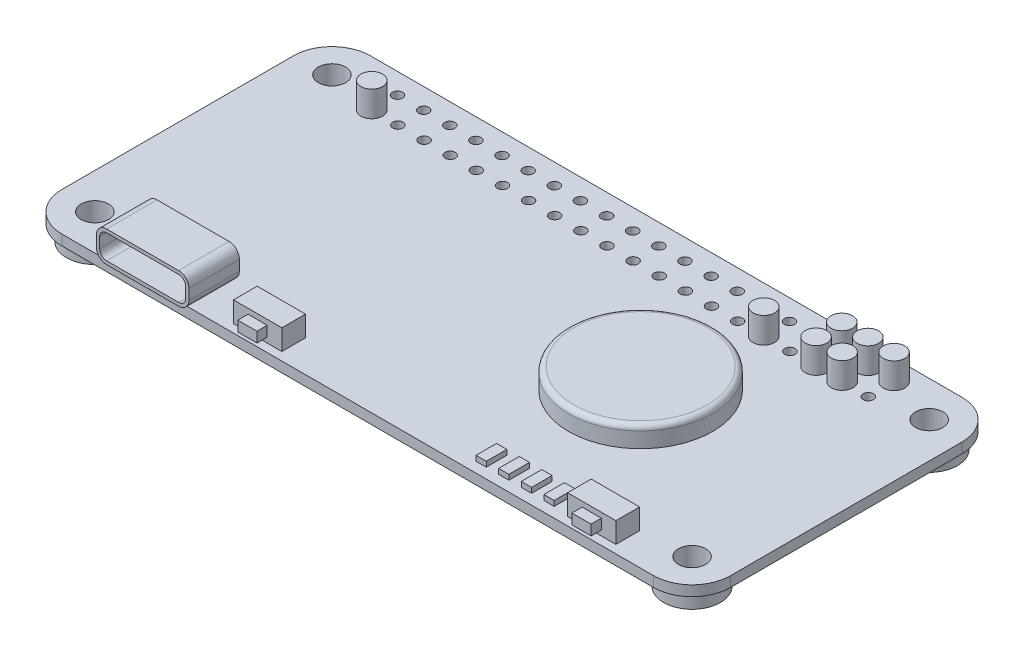
from build123d import *

# Parameters (mm, degrees)
BOSS_EXTRUDE1_DEPTH      = 1
SKETCH2_R                = 1.325
CUT_EXTRUDE1_DEPTH       = 36.80851854
SKETCH3_R                = 0.5
CUT_EXTRUDE2_DEPTH       = 36.80851854
LPATTERN1_COUNT          = 20
LPATTERN1_PITCH          = 2.54
BOSS_EXTRUDE6_DEPTH      = 0.4
BOSS_EXTRUDE6_DEPTH_BACK = 4.5
CUT_EXTRUDE9_DEPTH       = 5.25
SKETCH_1_W               = 4.7
SKETCH_1_H               = 2.3
EXTRUDE_1_DEPTH          = 2
SKETCH_2_W               = 1.86
SKETCH_2_H               = 1
EXTRUDE_2_DEPTH          = 1
SKETCH_9_R               = 2.75
SKETCH_9_R_2             = 1.325
EXTRUDE_8_DEPTH          = 1.5
SKETCH_10_R              = 1.05
EXTRUDE_9_DEPTH          = 2.5
SKETCH_11_R              = 0.5
EXTRUDE_10_DEPTH         = 3
SKETCH_12_R              = 7
EXTRUDE_11_DEPTH         = 2
SKETCH_13_W              = 1
SKETCH_13_H              = 2
EXTRUDE_12_DEPTH         = 0.5
FILLET_1_R               = 0.5
EXTRUDE_13_DEPTH         = 1


with BuildPart() as part:
    # Sketch1 → Boss-Extrude1 (new body)
    with BuildSketch(Plane(origin=(0, 0, 0), x_dir=(1, 0, 0), z_dir=(0, 1, 0))):
        with BuildLine():
            Line((-28.75, 15), (28.75, 15))
            ThreePointArc((28.75, 15), (31.401650429, 13.901650429), (32.5, 11.25))
            Line((32.5, 11.25), (32.5, -11.25))
            ThreePointArc((32.5, -11.25), (31.401650429, -13.901650429), (28.75, -15))
            Line((28.75, -15), (-28.75, -15))
            ThreePointArc((-28.75, -15), (-31.401650429, -13.901650429), (-32.5, -11.25))
            Line((-32.5, -11.25), (-32.5, 11.25))
            ThreePointArc((-32.5, 11.25), (-31.401650429, 13.901650429), (-28.75, 15))
        make_face()
    extrude(amount=BOSS_EXTRUDE1_DEPTH)

    # Sketch2 → Cut-Extrude1 (cut, through all)
    with BuildSketch(Plane(origin=(0, 1, 0), x_dir=(1, 0, 0), z_dir=(0, 1, 0))):
        with Locations(Location((-29.025, 11.525, 0), (0, 0, 270))):
            Circle(SKETCH2_R)
        with Locations(Location((29.025, 11.525, 0), (0, 0, 90))):
            Circle(SKETCH2_R)
        with Locations(Location((29.025, -11.525, 0), (0, 0, 270))):
            Circle(SKETCH2_R)
        with Locations(Location((-29.025, -11.525, 0), (0, 0, 90))):
            Circle(SKETCH2_R)
    extrude(amount=-CUT_EXTRUDE1_DEPTH, mode=Mode.SUBTRACT)

    # Sketch3 → Cut-Extrude2 (cut, through all)
    with BuildSketch(Plane(origin=(0, 1, 0), x_dir=(1, 0, 0), z_dir=(0, 1, 0))):
        with Locations(Location((-24.128, 13, 0), (0, 0, 270))):
            Circle(SKETCH3_R)
        with Locations(Location((-24.128, 10.5, 0), (0, 0, 270))):
            Circle(SKETCH3_R)
    cut_extrude2 = extrude(amount=-CUT_EXTRUDE2_DEPTH, mode=Mode.SUBTRACT)

    # LPattern1: Cut-Extrude2 ×20
    with Locations(*[(i * LPATTERN1_PITCH, 0, 0) for i in range(1, LPATTERN1_COUNT)]):
        add(cut_extrude2, mode=Mode.SUBTRACT)

    # Sketch15 → Boss-Extrude6 (add, two sides: drawn at the far end of the back side and taken through both)
    with BuildSketch(Plane.XY.offset(15).offset(-BOSS_EXTRUDE6_DEPTH_BACK)):
        with BuildLine():
            Line((-24, 4), (-17, 4))
            ThreePointArc((-17, 4), (-16.292893219, 3.707106781), (-16, 3))
            Line((-16, 3), (-16, 2))
            ThreePointArc((-16, 2), (-16.292893219, 1.292893219), (-17, 1))
            Line((-17, 1), (-24, 1))
            ThreePointArc((-24, 1), (-24.707106781, 1.292893219), (-25, 2))
            Line((-25, 2), (-25, 3))
            ThreePointArc((-25, 3), (-24.707106781, 3.707106781), (-24, 4))
        make_face()
    extrude(amount=BOSS_EXTRUDE6_DEPTH + BOSS_EXTRUDE6_DEPTH_BACK)

    # Sketch16 → Cut-Extrude9 (cut)
    with BuildSketch(Plane.XY.offset(15.4)):
        with BuildLine():
            Line((-17, 3.68), (-24, 3.68))
            ThreePointArc((-24, 3.68), (-24.480832611, 3.480832611), (-24.68, 3))
            Line((-24.68, 3), (-24.68, 2))
            ThreePointArc((-24.68, 2), (-24.480832611, 1.519167389), (-24, 1.32))
            Line((-24, 1.32), (-17, 1.32))
            ThreePointArc((-17, 1.32), (-16.519167389, 1.519167389), (-16.32, 2))
            Line((-16.32, 2), (-16.32, 3))
            ThreePointArc((-16.32, 3), (-16.519167389, 3.480832611), (-17, 3.68))
        make_face()
    extrude(amount=-CUT_EXTRUDE9_DEPTH, mode=Mode.SUBTRACT)

    # 草图1 → 凸台-拉伸1 (add)
    with BuildSketch(Plane(origin=(0, 1, 0), x_dir=(1, 0, 0), z_dir=(0, 1, 0))):
        with Locations((-10.52, -13.05)):
            Rectangle(SKETCH_1_W, SKETCH_1_H)
        with Locations((21.95, -13.05)):
            Rectangle(SKETCH_1_W, SKETCH_1_H)
    extrude(amount=EXTRUDE_1_DEPTH)

    # 草图2 → 凸台-拉伸2 (add)
    with BuildSketch(Plane.XY.offset(14.2)):
        with Locations((-10.52, 2)):
            Rectangle(SKETCH_2_W, SKETCH_2_H)
        with Locations((21.95, 2)):
            Rectangle(SKETCH_2_W, SKETCH_2_H)
    extrude(amount=EXTRUDE_2_DEPTH)

    # 草图9 → 凸台-拉伸8 (add)
    # profile 1 of 4: a face of its own
    with BuildSketch(Plane.XZ):
        with Locations(Location((29.025, 11.525, 0), (0, 0, 90))):
            Circle(SKETCH_9_R)
        with Locations(Location((29.025, 11.525, 0), (0, 0, 90))):
            Circle(SKETCH_9_R_2, mode=Mode.SUBTRACT)
    # profile 2 of 4: a face of its own
    with BuildSketch(Plane.XZ):
        with Locations(Location((29.025, -11.525, 0), (0, 0, 90))):
            Circle(SKETCH_9_R)
        with Locations(Location((29.025, -11.525, 0), (0, 0, 270))):
            Circle(SKETCH_9_R_2, mode=Mode.SUBTRACT)
    # profile 3 of 4: a face of its own
    with BuildSketch(Plane.XZ):
        with Locations(Location((-29.025, 11.525, 0), (0, 0, 90))):
            Circle(SKETCH_9_R)
        with Locations(Location((-29.025, 11.525, 0), (0, 0, 270))):
            Circle(SKETCH_9_R_2, mode=Mode.SUBTRACT)
    # profile 4 of 4: a face of its own
    with BuildSketch(Plane.XZ):
        with Locations(Location((-29.025, -11.525, 0), (0, 0, 90))):
            Circle(SKETCH_9_R)
        with Locations(Location((-29.025, -11.525, 0), (0, 0, 90))):
            Circle(SKETCH_9_R_2, mode=Mode.SUBTRACT)
    extrude(amount=EXTRUDE_8_DEPTH)

    # 草图10 → 凸台-拉伸9 (add)
    with BuildSketch(Plane(origin=(0, 1, 0), x_dir=(1, 0, 0), z_dir=(0, 1, 0))):
        with Locations(Location((24.132, 13, 0), (0, 0, 270))):
            Circle(SKETCH_10_R)
        with Locations(Location((21.592, 13, 0), (0, 0, 270))):
            Circle(SKETCH_10_R)
        with Locations(Location((19.052, 13, 0), (0, 0, 270))):
            Circle(SKETCH_10_R)
        with Locations(Location((21.592, 10.5, 0), (0, 0, 270))):
            Circle(SKETCH_10_R)
        with Locations(Location((19.052, 10.5, 0), (0, 0, 270))):
            Circle(SKETCH_10_R)
        with Locations(Location((-24.128, 10.5, 0), (0, 0, 270))):
            Circle(SKETCH_10_R)
        with Locations(Location((13.972, 10.5, 0), (0, 0, 270))):
            Circle(SKETCH_10_R)
    extrude(amount=EXTRUDE_9_DEPTH)

    # 草图11 → 凸台-拉伸10 (add)
    with BuildSketch(Plane.XZ.offset(-1)):
        with Locations(Location((24.132, -13, 0), (0, 0, 90))):
            Circle(SKETCH_11_R)
        with Locations(Location((21.592, -13, 0), (0, 0, 90))):
            Circle(SKETCH_11_R)
        with Locations(Location((21.592, -10.5, 0), (0, 0, 90))):
            Circle(SKETCH_11_R)
        with Locations(Location((19.052, -10.5, 0), (0, 0, 90))):
            Circle(SKETCH_11_R)
        with Locations(Location((19.052, -13, 0), (0, 0, 90))):
            Circle(SKETCH_11_R)
        with Locations(Location((-24.128, -10.5, 0), (0, 0, 90))):
            Circle(SKETCH_11_R)
    extrude(amount=EXTRUDE_10_DEPTH)

    # 草图12 → 凸台-拉伸11 (add)
    with BuildSketch(Plane(origin=(0, 1, 0), x_dir=(1, 0, 0), z_dir=(0, 1, 0))):
        with Locations(Location((12.5, 0, 0), (0, 0, 270))):
            Circle(SKETCH_12_R)
    extrude(amount=EXTRUDE_11_DEPTH)

    # 草图13 → 凸台-拉伸12 (add)
    with BuildSketch(Plane(origin=(0, 1, 0), x_dir=(1, 0, 0), z_dir=(0, 1, 0))):
        with Locations((17.6, -13)):
            Rectangle(SKETCH_13_W, SKETCH_13_H)
        with Locations((15.4, -13)):
            Rectangle(SKETCH_13_W, SKETCH_13_H)
        with Locations((13.2, -13)):
            Rectangle(SKETCH_13_W, SKETCH_13_H)
        with Locations((11, -13)):
            Rectangle(SKETCH_13_W, SKETCH_13_H)
    extrude(amount=EXTRUDE_12_DEPTH)

    # 圆角1
    fillet_1_edges = [part.edges().sort_by_distance(p)[0] for p in [
        (12.5, 3, -7),
    ]]
    fillet(fillet_1_edges, radius=FILLET_1_R)

    # 草图14 → 凸台-拉伸13 (add)
    with BuildSketch(Plane(origin=(0, 0, 10.5), x_dir=(-1, 0, 0), z_dir=(0, 0, -1))):
        with BuildLine():
            Line((16, 3), (16, 2))
            ThreePointArc((16, 2), (16.292893219, 1.292893219), (17, 1))
            Line((17, 1), (24, 1))
            ThreePointArc((24, 1), (24.707106781, 1.292893219), (25, 2))
            Line((25, 2), (25, 3))
            ThreePointArc((25, 3), (24.707106781, 3.707106781), (24, 4))
            Line((24, 4), (17, 4))
            ThreePointArc((17, 4), (16.292893219, 3.707106781), (16, 3))
        make_face()
    extrude(amount=-EXTRUDE_13_DEPTH)


solid = part.part
